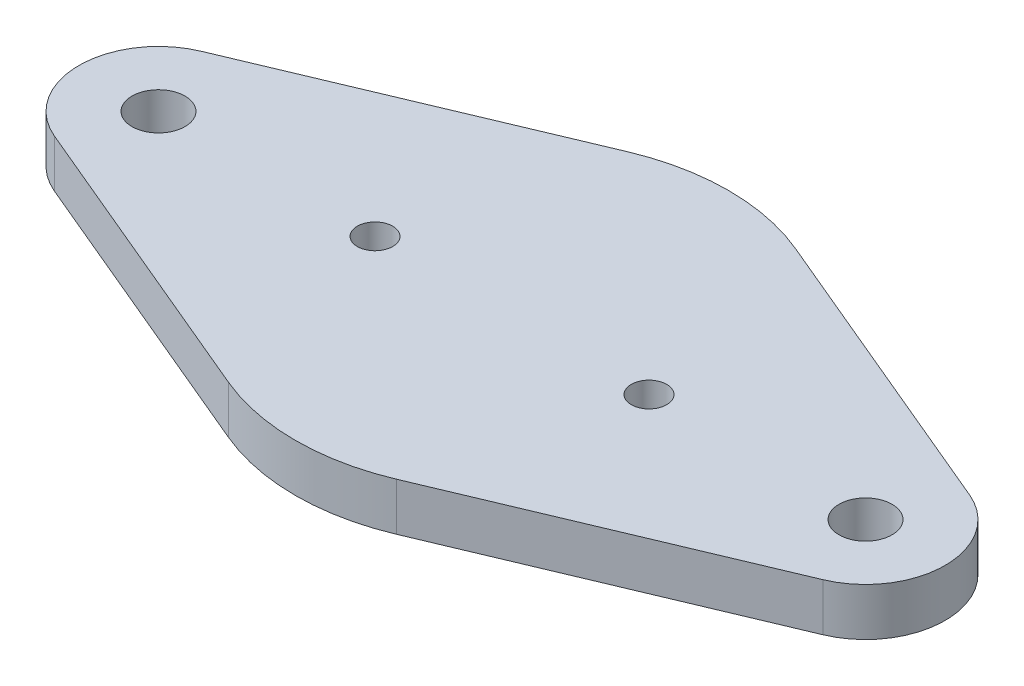
from build123d import *

# Parameters (mm, degrees)
BOSS_EXTRUDE1_DEPTH = 2.7
CUT_EXTRUDE1_REACH  = 29.525
SKETCH2_R           = 1.5
SKETCH2_R_2         = 1


with BuildPart() as part:
    # Sketch1 → Boss-Extrude1 (new body)
    with BuildSketch(Plane(origin=(0, 0, 0), x_dir=(1, 0, 0), z_dir=(0, 1, 0))):
        with BuildLine():
            Line((4.746875, 11.292903866), (21.74375, 4.148413665))
            ThreePointArc((21.74375, 4.148413665), (24.5, 0), (21.74375, -4.148413665))
            Line((21.74375, -4.148413665), (4.746875, -11.292903866))
            ThreePointArc((4.746875, -11.292903866), (0, -12.25), (-4.746875, -11.292903866))
            Line((-4.746875, -11.292903866), (-21.74375, -4.148413665))
            ThreePointArc((-21.74375, -4.148413665), (-24.5, 0), (-21.74375, 4.148413665))
            Line((-21.74375, 4.148413665), (-4.746875, 11.292903866))
            ThreePointArc((-4.746875, 11.292903866), (0, 12.25), (4.746875, 11.292903866))
        make_face()
    extrude(amount=BOSS_EXTRUDE1_DEPTH)

    # Sketch2 → Cut-Extrude1 (cut, up to next)
    with BuildSketch(Plane(origin=(0, 2.7, 0), x_dir=(1, 0, 0), z_dir=(0, 1, 0)), mode=Mode.PRIVATE) as cut_extrude1_sk1:
        with Locations(Location((-20, 0, 0), (0, 0, 270))):
            Circle(SKETCH2_R)
    cut_extrude1_tool1 = extrude(cut_extrude1_sk1.sketch, amount=-CUT_EXTRUDE1_REACH, mode=Mode.PRIVATE) & part.part
    # Sketch2 → Cut-Extrude1 (cut, up to next)
    with BuildSketch(Plane(origin=(0, 2.7, 0), x_dir=(1, 0, 0), z_dir=(0, 1, 0)), mode=Mode.PRIVATE) as cut_extrude1_sk2:
        with Locations(Location((20, 0, 0), (0, 0, 270))):
            Circle(SKETCH2_R)
    cut_extrude1_tool2 = extrude(cut_extrude1_sk2.sketch, amount=-CUT_EXTRUDE1_REACH, mode=Mode.PRIVATE) & part.part
    # Sketch2 → Cut-Extrude1 (cut, up to next)
    with BuildSketch(Plane(origin=(0, 2.7, 0), x_dir=(1, 0, 0), z_dir=(0, 1, 0)), mode=Mode.PRIVATE) as cut_extrude1_sk3:
        with Locations(Location((7.75, 0, 0), (0, 0, 270))):
            Circle(SKETCH2_R_2)
    cut_extrude1_tool3 = extrude(cut_extrude1_sk3.sketch, amount=-CUT_EXTRUDE1_REACH, mode=Mode.PRIVATE) & part.part
    # Sketch2 → Cut-Extrude1 (cut, up to next)
    with BuildSketch(Plane(origin=(0, 2.7, 0), x_dir=(1, 0, 0), z_dir=(0, 1, 0)), mode=Mode.PRIVATE) as cut_extrude1_sk4:
        with Locations(Location((-7.75, 0, 0), (0, 0, 270))):
            Circle(SKETCH2_R_2)
    cut_extrude1_tool4 = extrude(cut_extrude1_sk4.sketch, amount=-CUT_EXTRUDE1_REACH, mode=Mode.PRIVATE) & part.part
    add(cut_extrude1_tool1.solids().sort_by_distance((-20, 2.7, 0))[0], mode=Mode.SUBTRACT)
    add(cut_extrude1_tool2.solids().sort_by_distance((20, 2.7, 0))[0], mode=Mode.SUBTRACT)
    add(cut_extrude1_tool3.solids().sort_by_distance((7.75, 2.7, 0))[0], mode=Mode.SUBTRACT)
    add(cut_extrude1_tool4.solids().sort_by_distance((-7.75, 2.7, 0))[0], mode=Mode.SUBTRACT)


solid = part.part
